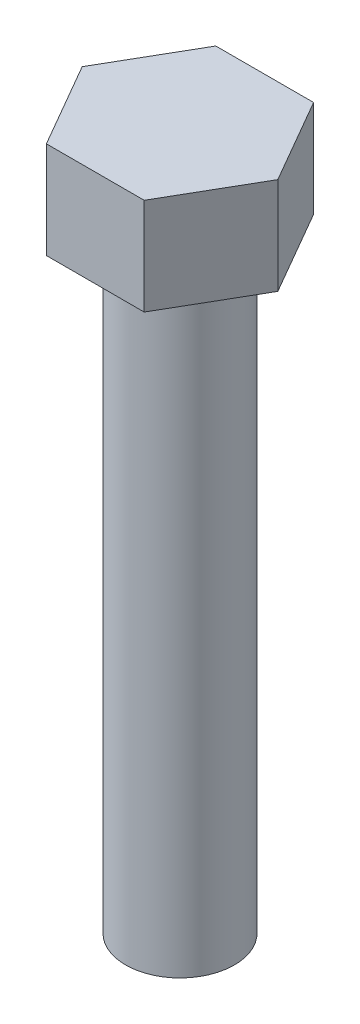
from build123d import *

# Parameters (mm, degrees)
SKETCH2_W           = 2.25
SKETCH2_H           = 25
BOSS_EXTRUDE1_DEPTH = 4


with BuildPart() as part:
    # Sketch2 → Revolve1 (revolve)
    with BuildSketch(Plane.XY, mode=Mode.PRIVATE) as revolve1_sk:
        with Locations((1.125, 12.5)):
            Rectangle(SKETCH2_W, SKETCH2_H)
    revolve(revolve1_sk.sketch.rotate(Axis((0, 0, 0), (0, 1, 0)), 90), axis=Axis((0, 0, 0), (0, 1, 0)))

    # Sketch3 → Boss-Extrude1 (add)
    with BuildSketch(Plane(origin=(0, 25, 0), x_dir=(1, 0, 0), z_dir=(0, 1, 0))):
        Polygon((4.041451884, 0), (2.020725942, 3.5), (-2.020725942, 3.5), (-4.041451884, 0), (-2.020725942, -3.5), (2.020725942, -3.5), align=None)
    extrude(amount=BOSS_EXTRUDE1_DEPTH)


solid = part.part
